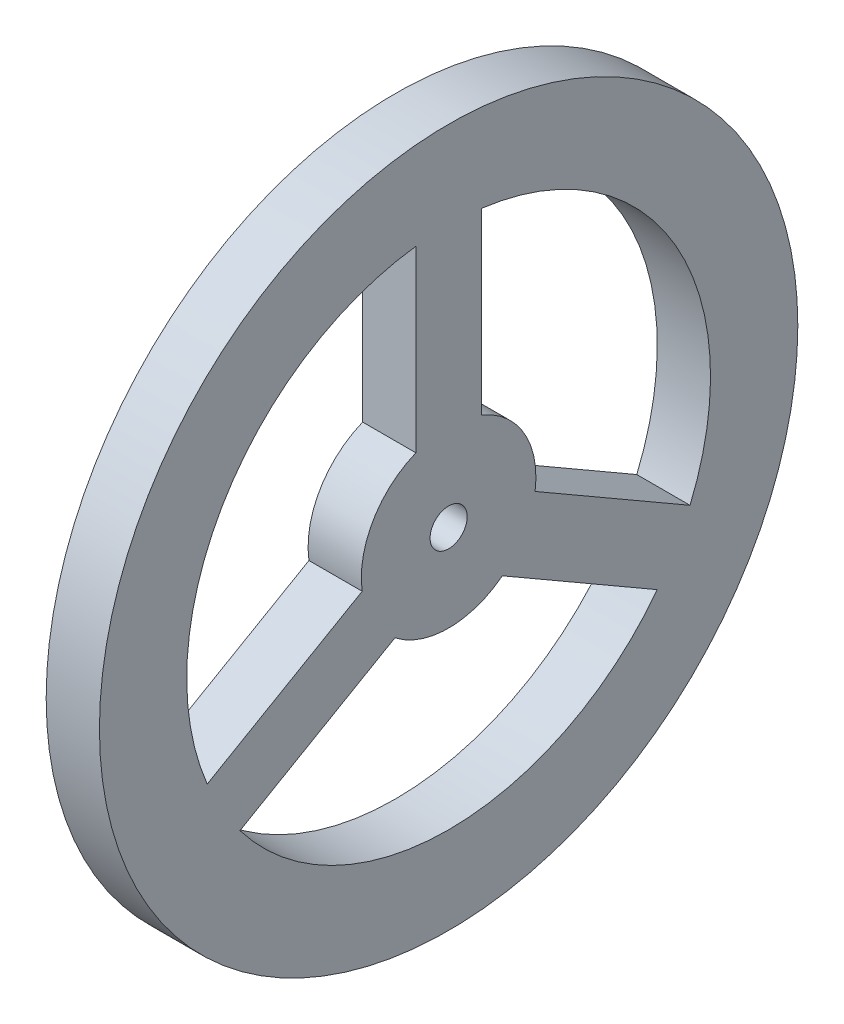
from build123d import *

# Parameters (mm, degrees)
SKETCH2_R           = 20.32
SKETCH2_R_2         = 1.0795
BOSS_EXTRUDE5_DEPTH = 3.0988


with BuildPart() as part:
    # Sketch2 → Boss-Extrude5 (new body)
    with BuildSketch(Plane(origin=(0, 0, 0), x_dir=(0, 0, -1), z_dir=(1, 0, 0))):
        Circle(SKETCH2_R)
        with BuildLine():
            Line((-12.142210048, -9.210012766), (-3.125861344, -4.004421414))
            ThreePointArc((-3.125861344, -4.004421414), (0, -5.08), (3.125861344, -4.004421414))
            Line((3.125861344, -4.004421414), (12.142210048, -9.210012766))
            ThreePointArc((12.142210048, -9.210012766), (0, -15.24), (-12.142210048, -9.210012766))
        make_face(mode=Mode.SUBTRACT)
        with BuildLine():
            ThreePointArc((-14.047210048, -5.910455977), (-13.198227154, 7.62), (-1.905, 15.120468743))
            Line((-1.905, 15.120468743), (-1.905, 4.709286039))
            ThreePointArc((-1.905, 4.709286039), (-4.399409051, 2.54), (-5.030861344, -0.704864625))
            Line((-5.030861344, -0.704864625), (-14.047210048, -5.910455977))
        make_face(mode=Mode.SUBTRACT)
        Circle(SKETCH2_R_2, mode=Mode.SUBTRACT)
        with BuildLine():
            Line((1.905, 4.709286039), (1.905, 15.120468743))
            ThreePointArc((1.905, 15.120468743), (13.198227154, 7.62), (14.047210048, -5.910455977))
            Line((14.047210048, -5.910455977), (5.030861344, -0.704864625))
            ThreePointArc((5.030861344, -0.704864625), (4.399409051, 2.54), (1.905, 4.709286039))
        make_face(mode=Mode.SUBTRACT)
    extrude(amount=BOSS_EXTRUDE5_DEPTH)


solid = part.part
